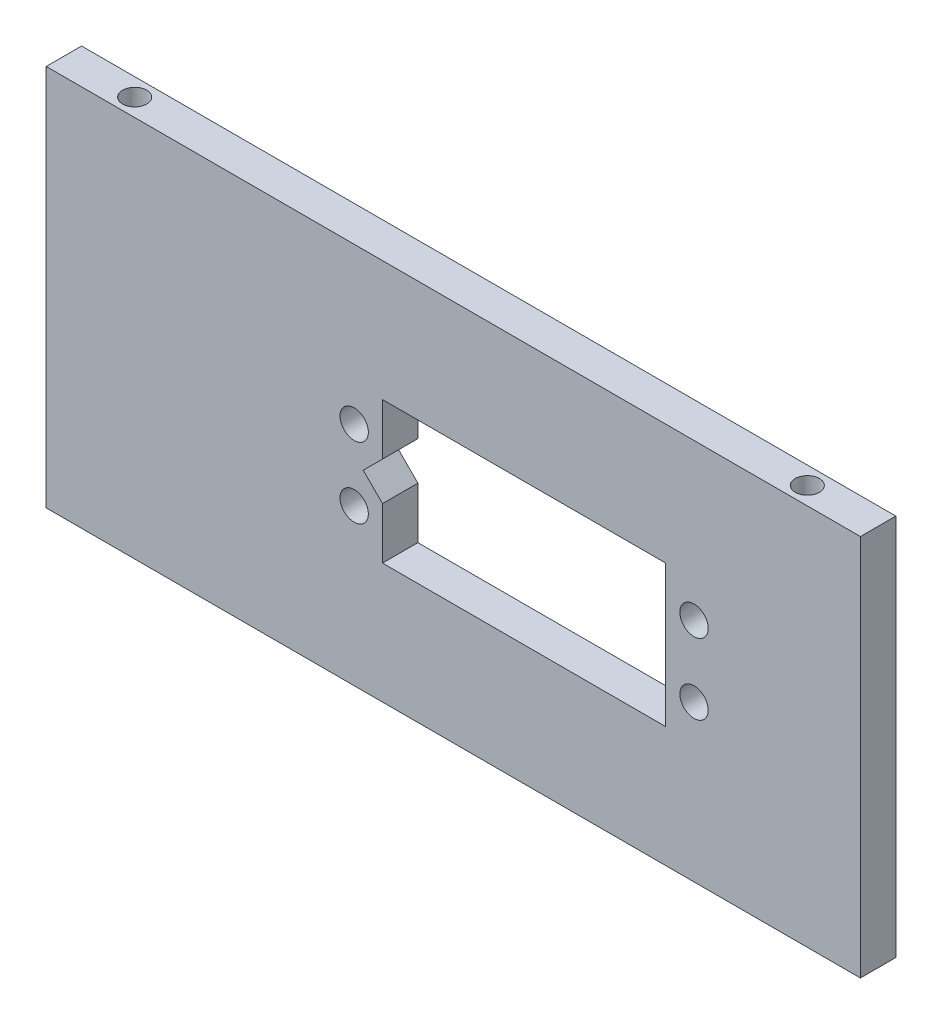
from build123d import *

# Parameters (mm, degrees)
SKETCH_1_W          = 115
SKETCH_1_H          = 54
SKETCH_1_R          = 2
SKETCH_1_W_2        = 40
SKETCH_1_H_2        = 20
EXTRUDE_3_DEPTH     = 5
SKETCH_3_R          = 1.75
CUT_EXTRUDE_2_DEPTH = 15
CUT_EXTRUDE_3_DEPTH = 10
SKETCH_5_R          = 1.7
CUT_EXTRUDE_4_DEPTH = 10


with BuildPart() as part:
    # 草圖1 → 填料-伸長3 (new body)
    with BuildSketch(Plane.XY):
        with Locations((13.062480584, -3.484099434)):
            Rectangle(SKETCH_1_W, SKETCH_1_H)
        with Locations((-0.937519416, -8.484099434)):
            Circle(SKETCH_1_R, mode=Mode.SUBTRACT)
        with Locations((47.062480584, -8.484099434)):
            Circle(SKETCH_1_R, mode=Mode.SUBTRACT)
        with Locations((-0.937519416, 1.515900566)):
            Circle(SKETCH_1_R, mode=Mode.SUBTRACT)
        with Locations((47.062480584, 1.515900566)):
            Circle(SKETCH_1_R, mode=Mode.SUBTRACT)
        with Locations((23.062480584, -3.484099434)):
            Rectangle(SKETCH_1_W_2, SKETCH_1_H_2, mode=Mode.SUBTRACT)
    extrude(amount=EXTRUDE_3_DEPTH)

    # 草圖3 → 除料-伸長2 (cut)
    with BuildSketch(Plane.XZ.offset(30.484099434)):
        with Locations(Location((29.062480584, 2.5, 0), (0, 0, 270))):
            Circle(SKETCH_3_R)
        with Locations(Location((-2.937519416, 2.5, 0), (0, 0, 270))):
            Circle(SKETCH_3_R)
    extrude(amount=-CUT_EXTRUDE_2_DEPTH, mode=Mode.SUBTRACT)

    # 草圖4 → 除料-伸長3 (cut)
    with BuildSketch(Plane.XY.offset(5)):
        Polygon((0.340707034, -3.484099434), (3.062480584, -6.205872984), (3.062480584, -0.762325884), align=None)
    extrude(amount=-CUT_EXTRUDE_3_DEPTH, mode=Mode.SUBTRACT)

    # 草圖5 → 除料-伸長4 (cut)
    with BuildSketch(Plane(origin=(0, 23.515900566, 0), x_dir=(1, 0, 0), z_dir=(0, 1, 0))):
        with Locations(Location((60.562480584, -2.5, 0), (0, 0, 270))):
            Circle(SKETCH_5_R)
        with Locations(Location((-34.437519416, -2.5, 0), (0, 0, 270))):
            Circle(SKETCH_5_R)
    extrude(amount=-CUT_EXTRUDE_4_DEPTH, mode=Mode.SUBTRACT)


solid = part.part
